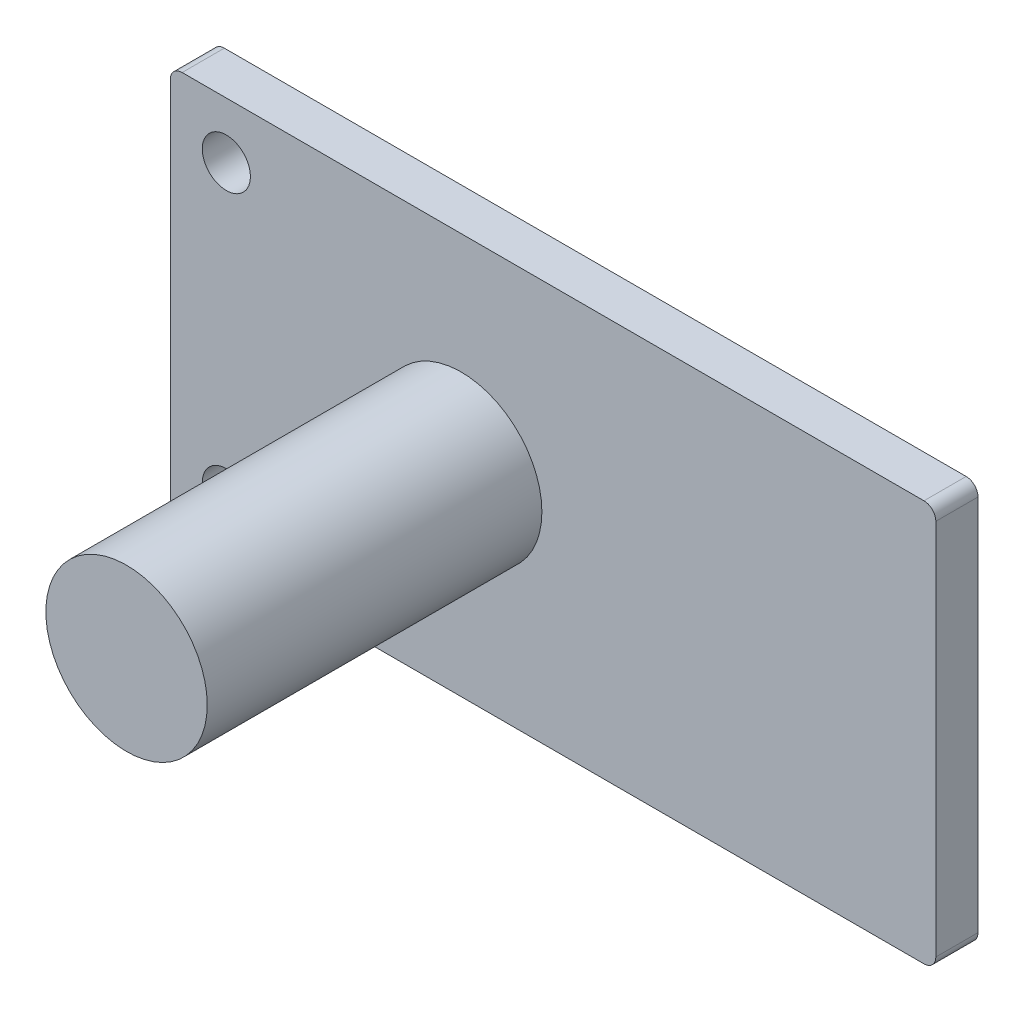
from build123d import *

# Parameters (mm, degrees)
MEASURED_ENCODER_PCB_DEPTH         = 1.78
SKETCH_2_R                         = 1.015
MEASURED_ENCODER_MOUNT_HOLES_DEPTH = 2
SHAFT_CLEARANCE_REFERENCE_START    = 1.78
SKETCH_3_R                         = 3.405
SHAFT_CLEARANCE_REFERENCE_DEPTH    = 14.12


with BuildPart() as part:
    # 草图1 → Measured_encoder_PCB (new body)
    with BuildSketch(Plane.XY):
        with BuildLine():
            Line((0.5, 0), (31.8, 0))
            ThreePointArc((31.8, 0), (32.153553391, 0.146446609), (32.3, 0.5))
            Line((32.3, 0.5), (32.3, 16.42))
            ThreePointArc((32.3, 16.42), (32.153553391, 16.773553391), (31.8, 16.92))
            Line((31.8, 16.92), (0.5, 16.92))
            ThreePointArc((0.5, 16.92), (0.146446609, 16.773553391), (0, 16.42))
            Line((0, 16.42), (0, 0.5))
            ThreePointArc((0, 0.5), (0.146446609, 0.146446609), (0.5, 0))
        make_face()
    extrude(amount=MEASURED_ENCODER_PCB_DEPTH)

    # 草图2 → Measured_encoder_mount_holes (cut)
    with BuildSketch(Plane.XY):
        with Locations((2.365, 2.365)):
            Circle(SKETCH_2_R)
        with Locations((2.365, 14.555)):
            Circle(SKETCH_2_R)
    extrude(amount=MEASURED_ENCODER_MOUNT_HOLES_DEPTH, mode=Mode.SUBTRACT)

    # 草图3 → Shaft_clearance_reference (add)
    with BuildSketch(Plane.XY.offset(SHAFT_CLEARANCE_REFERENCE_START)):
        with Locations((12.275, 8.46)):
            Circle(SKETCH_3_R)
    extrude(amount=SHAFT_CLEARANCE_REFERENCE_DEPTH)


solid = part.part
